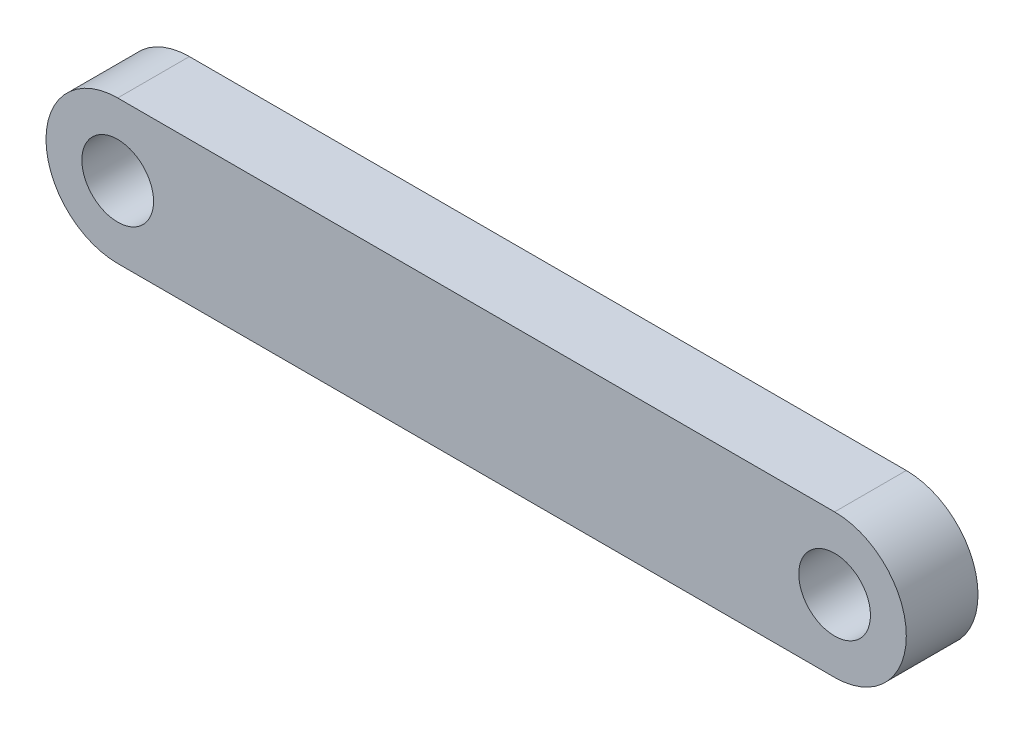
from build123d import *

# Parameters (mm, degrees)
SKETCH1_R           = 5
BOSS_EXTRUDE1_DEPTH = 10


with BuildPart() as part:
    # Sketch1 → Boss-Extrude1 (new body)
    with BuildSketch(Plane.XY):
        with BuildLine():
            Line((0, 10), (100, 10))
            ThreePointArc((100, 10), (110, 0), (100, -10))
            Line((100, -10), (0, -10))
            ThreePointArc((0, -10), (-10, 0), (0, 10))
        make_face()
        Circle(SKETCH1_R, mode=Mode.SUBTRACT)
        with Locations((100, 0)):
            Circle(SKETCH1_R, mode=Mode.SUBTRACT)
    extrude(amount=BOSS_EXTRUDE1_DEPTH)


solid = part.part
